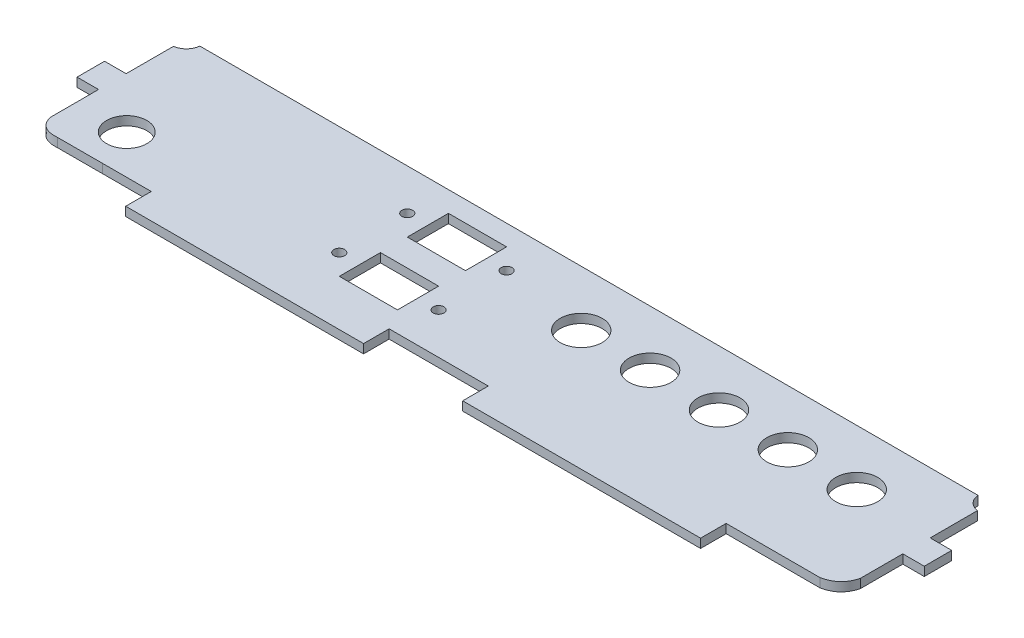
from build123d import *

# Parameters (mm, degrees)
BOSS_EXTRUDE1_DEPTH = 2.54
SKETCH3_R           = 5.969
CUT_EXTRUDE1_DEPTH  = 2.54
SKETCH4_R           = 1.524
SKETCH4_W           = 16.51
SKETCH4_H           = 11.684
CUT_EXTRUDE2_DEPTH  = 2.54
SKETCH5_R           = 5.715
CUT_EXTRUDE3_DEPTH  = 2.54
SKETCH6_W           = 1.070588236
SKETCH6_H           = 0.452941176
SKETCH6_H_2         = 2.882352942
BOSS_EXTRUDE2_DEPTH = 1.27


with BuildPart() as part:
    # Sketch2 → Boss-Extrude1 (new body)
    with BuildSketch(Plane(origin=(0, -13.278506449, 0), x_dir=(1, 0, 0), z_dir=(0, 1, 0))):
        with BuildLine():
            Line((-34.651907333, 8.791338925), (-34.651907333, 12.282836544))
            Line((-34.651907333, 12.282836544), (-34.651907333, 16.052095858))
            Line((-34.651907333, 16.052095858), (-6.504225525, 16.052095858))
            Line((-6.504225525, 16.052095858), (-6.504225525, 12.282836544))
            Line((-6.504225525, 12.282836544), (-6.504225525, 8.791338925))
            Line((-6.504225525, 8.791338925), (61.033352999, 8.795836626))
            Line((61.033352999, 8.795836626), (61.033352999, 12.261437791))
            Line((61.033352999, 12.261437791), (61.033352999, 16.052095858))
            Line((61.033352999, 16.052095858), (74.928287754, 16.052095858))
            Line((74.928287754, 16.052095858), (87.628299114, 16.052095858))
            add(Edge.make_bspline(
                [(87.628299114, 16.052095858), (92.376375428, 16.944548934), (93.595788319, 21.590182824)],
                knots=[0, 0, 0, 1, 1, 1], degree=2))
            Line((93.595788319, 21.590182824), (93.595788319, 33.644651336))
            Line((93.595788319, 33.644651336), (96.76835331, 33.644651336))
            Line((96.76835331, 33.644651336), (99.689276569, 33.644651336))
            Line((99.689276569, 33.644651336), (99.688757031, 41.446050547))
            Line((99.688757031, 41.446050547), (93.5671706, 41.446050547))
            Line((93.5671706, 41.446050547), (93.5671706, 54.894977019))
            ThreePointArc((93.5671706, 54.894977019), (91.056320502, 56.150010308), (89.8898168, 58.703193788))
            Line((89.8898168, 58.703193788), (67.098084888, 58.703193788))
            Line((67.098084888, 58.703193788), (-108.254217747, 58.703193788))
            Line((-108.254217747, 58.703193788), (-131.045949658, 58.703193788))
            ThreePointArc((-131.045949658, 58.703193788), (-132.21245336, 56.150010308), (-134.723303458, 54.894977019))
            Line((-134.723303458, 54.894977019), (-134.723303458, 41.446050547))
            Line((-134.723303458, 41.446050547), (-140.844889889, 41.446050547))
            Line((-140.844889889, 41.446050547), (-140.845409427, 33.644651336))
            Line((-140.845409427, 33.644651336), (-137.924486169, 33.644651336))
            Line((-137.924486169, 33.644651336), (-134.751921178, 33.644651336))
            Line((-134.751921178, 33.644651336), (-134.750317455, 20.009499149))
            add(Edge.make_bspline(
                [(-134.750317455, 20.009499149), (-133.771402633, 15.691001725), (-128.784431972, 16.03703279)],
                knots=[0, 0, 0, 1, 1, 1], degree=2))
            Line((-128.784431972, 16.03703279), (-116.084420612, 16.052095858))
            Line((-116.084420612, 16.052095858), (-102.189485857, 16.052095858))
            Line((-102.189485857, 16.052095858), (-102.189485857, 12.261437791))
            Line((-102.189485857, 12.261437791), (-102.189485857, 8.795836626))
            Line((-102.189485857, 8.795836626), (-34.651907333, 8.791338925))
        make_face()
    extrude(amount=BOSS_EXTRUDE1_DEPTH)

    # Sketch3 → Cut-Extrude1 (cut)
    with BuildSketch(Plane(origin=(0, -10.738506449, 0), x_dir=(1, 0, 0), z_dir=(0, 1, 0))):
        with Locations(Location((-6.989066429, 42.921095968, 0), (0, 0, 270))):
            Circle(SKETCH3_R)
        with Locations(Location((12.568933571, 42.921095968, 0), (0, 0, 270))):
            Circle(SKETCH3_R)
        with Locations(Location((32.126933571, 42.921095968, 0), (0, 0, 270))):
            Circle(SKETCH3_R)
        with Locations(Location((51.684933571, 42.921095968, 0), (0, 0, 270))):
            Circle(SKETCH3_R)
        with Locations(Location((71.242933571, 42.921095968, 0), (0, 0, 270))):
            Circle(SKETCH3_R)
    extrude(amount=-CUT_EXTRUDE1_DEPTH, mode=Mode.SUBTRACT)

    # Sketch4 → Cut-Extrude2 (cut)
    with BuildSketch(Plane(origin=(0, -10.738506449, 0), x_dir=(1, 0, 0), z_dir=(0, 1, 0))):
        with Locations(Location((-32.279112135, 47.029644823, 0), (0, 0, 270))):
            Circle(SKETCH4_R)
        with Locations(Location((-60.473112135, 47.029644823, 0), (0, 0, 90))):
            Circle(SKETCH4_R)
        with Locations(Location((-60.473112135, 27.725644823, 0), (0, 0, 270))):
            Circle(SKETCH4_R)
        with Locations(Location((-32.279112135, 27.725644823, 0), (0, 0, 90))):
            Circle(SKETCH4_R)
        with Locations((-46.376112135, 47.029644823)):
            Rectangle(SKETCH4_W, SKETCH4_H)
        with Locations((-46.376112135, 27.725644823)):
            Rectangle(SKETCH4_W, SKETCH4_H)
    extrude(amount=-CUT_EXTRUDE2_DEPTH, mode=Mode.SUBTRACT)

    # Sketch5 → Cut-Extrude3 (cut)
    with BuildSketch(Plane(origin=(0, -10.738506449, 0), x_dir=(1, 0, 0), z_dir=(0, 1, 0))):
        with Locations(Location((-120.283334311, 27.185206684, 0), (0, 0, 270))):
            Circle(SKETCH5_R)
    extrude(amount=-CUT_EXTRUDE3_DEPTH, mode=Mode.SUBTRACT)

    # Sketch6 → Boss-Extrude2 (add)
    # profile 1 of 12: a face of its own
    with BuildSketch(Plane.XZ.offset(13.278506449)):
        with BuildLine():
            Line((-112.734008416, -19.687217596), (-111.637041504, -19.687217596))
            add(Edge.make_bspline(
                [(-111.637041504, -19.687217596), (-111.601008667, -19.687211947), (-111.531071442, -19.687200982), (-111.429412377, -19.690802953), (-111.334184822, -19.695266897), (-111.245304398, -19.700602899), (-111.16292082, -19.709041908), (-111.087015383, -19.719442496), (-111.017373241, -19.730649661), (-110.935507396, -19.748368995), (-110.843444854, -19.773606128), (-110.745550324, -19.812012352), (-110.661428024, -19.85590395), (-110.592984403, -19.908411948), (-110.53629973, -19.96613189), (-110.490342298, -20.029473817), (-110.454414733, -20.098969692), (-110.432648346, -20.161628981), (-110.41884369, -20.216176565), (-110.41101832, -20.262950346), (-110.402864753, -20.314762645), (-110.39775236, -20.372177024), (-110.392094766, -20.434526855), (-110.389312701, -20.502148845), (-110.387257103, -20.575071756), (-110.38705467, -20.625481558), (-110.386949593, -20.651647743)],
                knots=[0, 0, 0, 0, 1.377982312, 2.674567649, 3.889839969, 5.024138552, 6.079412034, 7.056120119, 7.954169122, 8.776225565, 10.258906682, 11.599246215, 12.791944274, 13.87465655, 14.883885279, 15.876478616, 16.85597234, 17.865101075, 18.406193072, 19.006295369, 19.67791914, 20.411631679, 21.209939595, 22.072139174, 22.999306481, 24, 24, 24, 24], degree=3))
            Line((-110.386949593, -20.651647743), (-110.386949593, -20.952107301))
            add(Edge.make_bspline(
                [(-110.386949593, -20.952107301), (-110.387166144, -20.978707163), (-110.387583776, -21.030006593), (-110.39162343, -21.104247405), (-110.397427418, -21.172848069), (-110.407756863, -21.235802887), (-110.418338632, -21.293490876), (-110.433794424, -21.345234047), (-110.449805228, -21.391961084), (-110.470301329, -21.433197839), (-110.493906499, -21.4707992), (-110.521653763, -21.505414347), (-110.553609273, -21.538145787), (-110.590254928, -21.568056163), (-110.631223285, -21.595919318), (-110.676463124, -21.621594278), (-110.726029334, -21.645452892), (-110.780248638, -21.666667065), (-110.83887419, -21.684894779), (-110.901351643, -21.702151274), (-110.968580784, -21.715001924), (-111.039705186, -21.727043464), (-111.115381204, -21.734845165), (-111.195154547, -21.741506685), (-111.27949836, -21.745330441), (-111.337221763, -21.745800229), (-111.366820916, -21.746041125)],
                knots=[0, 0, 0, 0, 1.291137889, 2.490036882, 3.608873441, 4.630748452, 5.586298936, 6.452920994, 7.249893365, 7.980894276, 8.682771907, 9.40143594, 10.130283677, 10.899433994, 11.693545186, 12.532910727, 13.422309217, 14.361902714, 15.356253204, 16.401773359, 17.506375272, 18.677097529, 19.902686196, 21.197847375, 22.563124469, 24, 24, 24, 24], degree=3))
            Line((-111.366820916, -21.746041125), (-111.663420181, -21.746041125))
            Line((-111.663420181, -21.746041125), (-111.663420181, -23.187217596))
            Line((-111.663420181, -23.187217596), (-112.734008416, -23.187217596))
            Line((-112.734008416, -23.187217596), (-112.734008416, -19.687217596))
        make_face()
        with BuildLine():
            Line((-111.663420181, -20.263688184), (-111.663420181, -21.16764039))
            add(Edge.make_bspline(
                [(-111.663420181, -21.16764039), (-111.647980055, -21.168116881), (-111.619461998, -21.168996965), (-111.590933189, -21.169390204), (-111.577850328, -21.169570537)],
                knots=[0, 0, 0, 0, 1.082831556, 2, 2, 2, 2], degree=3))
            add(Edge.make_bspline(
                [(-111.577850328, -21.169570537), (-111.553156332, -21.168898706), (-111.507306675, -21.167651309), (-111.444299818, -21.157123916), (-111.393767469, -21.136877331), (-111.359570215, -21.113611173), (-111.339434551, -21.089098438), (-111.327477355, -21.066542679), (-111.316188114, -21.040448854), (-111.307522756, -21.009945304), (-111.301365907, -20.974984996), (-111.295956556, -20.93617339), (-111.293887452, -20.892935396), (-111.293193532, -20.862891302), (-111.292831945, -20.847235978)],
                knots=[0, 0, 0, 0, 1.745339567, 3.240594206, 4.48460764, 5.569947629, 6.119139576, 6.70945562, 7.368186125, 8.125998689, 8.943453317, 9.875901568, 10.893178495, 12, 12, 12, 12], degree=3))
            Line((-111.292831945, -20.847235978), (-111.292831945, -20.55514039))
            add(Edge.make_bspline(
                [(-111.292831945, -20.55514039), (-111.293540477, -20.527416353), (-111.294836278, -20.47671315), (-111.307468797, -20.408270251), (-111.3295063, -20.354777901), (-111.357729165, -20.321683388), (-111.38612752, -20.304470121), (-111.411780949, -20.293632574), (-111.441916321, -20.284090448), (-111.47701805, -20.276421465), (-111.516846495, -20.271024085), (-111.561456517, -20.266345785), (-111.610849766, -20.263897881), (-111.645403272, -20.263760051), (-111.663420181, -20.263688184)],
                knots=[0, 0, 0, 0, 1.772995338, 3.242548813, 4.428381502, 5.439307395, 5.957193692, 6.541067122, 7.218146696, 7.97731862, 8.837122214, 9.78893594, 10.847105721, 12, 12, 12, 12], degree=3))
        make_face(mode=Mode.SUBTRACT)
    # profile 2 of 12: a face of its own
    with BuildSketch(Plane.XZ.offset(13.278506449)):
        with BuildLine():
            Line((-107.792831945, -21.320122007), (-107.792831945, -22.02076539))
            add(Edge.make_bspline(
                [(-107.792831945, -22.02076539), (-107.79296511, -22.051862543), (-107.793222282, -22.111918678), (-107.794910518, -22.198807429), (-107.79890578, -22.279237543), (-107.8039406, -22.353251809), (-107.810280272, -22.420845092), (-107.817968448, -22.482000688), (-107.82664662, -22.536844715), (-107.841181011, -22.601442178), (-107.866445974, -22.676985478), (-107.908443529, -22.763852412), (-107.965712205, -22.846101517), (-108.033348552, -22.9256687), (-108.112594884, -22.999337371), (-108.204628502, -23.061668401), (-108.306373469, -23.114931566), (-108.418853803, -23.157068594), (-108.54083515, -23.188686779), (-108.671420682, -23.211672672), (-108.8107647, -23.226177797), (-108.906704248, -23.227641143), (-108.95606724, -23.228394066)],
                knots=[0, 0, 0, 0, 0.951826186, 1.838206891, 2.65967189, 3.416374914, 4.108730704, 4.73728139, 5.302752647, 5.807553382, 6.762407774, 7.73412555, 8.750045002, 9.820868952, 10.926535816, 12.049947676, 13.212620023, 14.43418931, 15.717495654, 17.064349177, 18.489543579, 20, 20, 20, 20], degree=3))
            add(Edge.make_bspline(
                [(-108.95606724, -23.228394066), (-109.010565417, -23.227771884), (-109.115421762, -23.226574785), (-109.266045831, -23.214220095), (-109.403845387, -23.194531954), (-109.528912937, -23.167584529), (-109.640799647, -23.131651437), (-109.739832056, -23.088125122), (-109.825611052, -23.035838562), (-109.898960756, -22.975402297), (-109.959853507, -22.906508732), (-110.011794354, -22.831676768), (-110.053538523, -22.749708493), (-110.081545174, -22.676449611), (-110.098151701, -22.612309965), (-110.110057394, -22.558335643), (-110.118486048, -22.49826616), (-110.126196748, -22.432840888), (-110.132772909, -22.361635032), (-110.137066061, -22.284812231), (-110.139703243, -22.202218205), (-110.13982687, -22.14536926), (-110.139890769, -22.115985978)],
                knots=[0, 0, 0, 0, 1.707197647, 3.284706255, 4.731011971, 6.066207974, 7.288044814, 8.406936959, 9.447572882, 10.42576728, 11.372722643, 12.319558801, 13.27221848, 14.248194852, 14.769758696, 15.346999647, 15.978942594, 16.669045749, 17.4112251, 18.218920944, 19.079420947, 20, 20, 20, 20], degree=3))
            Line((-110.139890769, -22.115985978), (-110.139890769, -21.382530096))
            add(Edge.make_bspline(
                [(-110.139890769, -21.382530096), (-110.139789002, -21.350136612), (-110.13959139, -21.287234752), (-110.13390453, -21.195637306), (-110.126644292, -21.10951878), (-110.115662379, -21.028787764), (-110.101736169, -20.953567186), (-110.084330282, -20.883738309), (-110.064003815, -20.819349469), (-110.039861958, -20.760000549), (-110.012119437, -20.704291169), (-109.978493976, -20.652404786), (-109.939995511, -20.603081774), (-109.897332309, -20.555961064), (-109.848143029, -20.512878638), (-109.795099328, -20.471672924), (-109.736524244, -20.433490249), (-109.673190845, -20.398262371), (-109.604761462, -20.3667563), (-109.531671952, -20.339068417), (-109.45419307, -20.315179266), (-109.371710052, -20.296779626), (-109.285146766, -20.282140063), (-109.193925813, -20.271074348), (-109.09813559, -20.264613444), (-109.032639663, -20.264001078), (-108.999173857, -20.263688184)],
                knots=[0, 0, 0, 0, 1.258706802, 2.44416437, 3.565534099, 4.617009745, 5.609303903, 6.537196619, 7.412339861, 8.23113112, 9.02510996, 9.827401574, 10.629346738, 11.455234546, 12.293479631, 13.167073488, 14.0640531, 15.008016506, 15.981366345, 16.989117999, 18.043760349, 19.129561911, 20.271010871, 21.45476768, 22.699487801, 24, 24, 24, 24], degree=3))
            add(Edge.make_bspline(
                [(-108.999173857, -20.263688184), (-108.943574138, -20.264451365), (-108.836390017, -20.265922612), (-108.681816788, -20.283458204), (-108.539133349, -20.309208298), (-108.409578597, -20.348370218), (-108.293090152, -20.39496967), (-108.190035772, -20.448267588), (-108.100558741, -20.507947772), (-108.026300007, -20.575572199), (-107.964953421, -20.646805282), (-107.912272254, -20.718258386), (-107.871917009, -20.792053215), (-107.845306658, -20.85531873), (-107.830140125, -20.908936894), (-107.819694431, -20.953319177), (-107.811650809, -21.002586104), (-107.804381081, -21.056620256), (-107.799593758, -21.11569078), (-107.795739796, -21.179611249), (-107.792997588, -21.248254319), (-107.792888302, -21.295670695), (-107.792831945, -21.320122007)],
                knots=[0, 0, 0, 0, 1.801631376, 3.473152024, 5.037220677, 6.495666735, 7.852619042, 9.099671228, 10.250940686, 11.328981893, 12.344089199, 13.29540261, 14.201001808, 15.064772264, 15.513644716, 16.006116267, 16.54220296, 17.131223678, 17.773294144, 18.462883315, 19.207351473, 20, 20, 20, 20], degree=3))
        make_face()
        with BuildLine():
            add(Edge.make_bspline(
                [(-108.82224371, -21.096224949), (-108.822401311, -21.078423723), (-108.822699466, -21.044746882), (-108.8239962, -20.996702046), (-108.825853771, -20.954009257), (-108.828320555, -20.916231956), (-108.831740592, -20.883711652), (-108.837464053, -20.856419975), (-108.841782696, -20.833946095), (-108.850267789, -20.811528422), (-108.865535822, -20.789516429), (-108.891196172, -20.769448755), (-108.925684432, -20.76005108), (-108.950456118, -20.758591404), (-108.963787828, -20.757805831)],
                knots=[0, 0, 0, 0, 1.529875524, 2.894259986, 4.130367399, 5.201898635, 6.14835708, 6.936372256, 7.598090249, 8.111515645, 8.985769879, 9.866797629, 10.851945915, 12, 12, 12, 12], degree=3))
            add(Edge.make_bspline(
                [(-108.963787828, -20.757805831), (-108.977349522, -20.758549418), (-109.002365496, -20.759921042), (-109.037232993, -20.76976444), (-109.063847493, -20.789404431), (-109.080351448, -20.811396969), (-109.089654093, -20.833887938), (-109.095014952, -20.85625574), (-109.09920517, -20.883861129), (-109.103942765, -20.91618139), (-109.107017739, -20.953989537), (-109.108679566, -20.996703033), (-109.110037201, -21.044746589), (-109.110326228, -21.078423622), (-109.110479004, -21.096224949)],
                knots=[0, 0, 0, 0, 1.15856243, 2.137090529, 3.04157699, 3.931306771, 4.448136327, 5.109727602, 5.889229331, 6.831642005, 7.897388628, 9.125189412, 10.480405224, 12, 12, 12, 12], degree=3))
            Line((-109.110479004, -21.096224949), (-109.110479004, -22.404221272))
            add(Edge.make_bspline(
                [(-109.110479004, -22.404221272), (-109.110121798, -22.435539015), (-109.10947529, -22.492221109), (-109.104811553, -22.56856294), (-109.096786692, -22.627157927), (-109.084542912, -22.670321806), (-109.06507154, -22.700868567), (-109.037904873, -22.72058158), (-109.004187768, -22.732570092), (-108.97955515, -22.733681255), (-108.966361357, -22.734276419)],
                knots=[0, 0, 0, 0, 1.835619617, 3.322294424, 4.479629889, 5.298520436, 5.933029576, 6.561533762, 7.229524616, 8, 8, 8, 8], degree=3))
            add(Edge.make_bspline(
                [(-108.966361357, -22.734276419), (-108.952791435, -22.733540227), (-108.927760282, -22.732182243), (-108.893282887, -22.722334281), (-108.866876693, -22.703559315), (-108.847518431, -22.675844747), (-108.836277591, -22.63604195), (-108.827816034, -22.582787209), (-108.823276059, -22.513230552), (-108.822611545, -22.461698546), (-108.82224371, -22.433173478)],
                knots=[0, 0, 0, 0, 0.849535228, 1.56705728, 2.211546411, 2.837309577, 3.643864105, 4.773790255, 6.214161309, 8, 8, 8, 8], degree=3))
            Line((-108.82224371, -22.433173478), (-108.82224371, -21.096224949))
        make_face(mode=Mode.SUBTRACT)
    # profile 3 of 12: a face of its own
    with BuildSketch(Plane.XZ.offset(13.278506449)):
        with BuildLine():
            Line((-104.086949593, -20.304864654), (-104.509008416, -23.187217596))
            Line((-104.509008416, -23.187217596), (-105.600184887, -23.187217596))
            add(Edge.make_bspline(
                [(-105.600184887, -23.187217596), (-105.60788002, -23.140675397), (-105.623874162, -23.0439386), (-105.649314147, -22.893265458), (-105.67509898, -22.7311789), (-105.704715155, -22.558075149), (-105.734353094, -22.373253994), (-105.767654769, -22.177388898), (-105.801426839, -21.970130046), (-105.824907008, -21.828388643), (-105.836949593, -21.75569186)],
                knots=[0, 0, 0, 0, 0.780287423, 1.62180793, 2.527484367, 3.494970697, 4.526610144, 5.623561146, 6.78116447, 8, 8, 8, 8], degree=3))
            add(Edge.make_bspline(
                [(-105.836949593, -21.75569186), (-105.859424687, -21.892524993), (-105.903569095, -22.16128549), (-105.9482145, -22.429963214), (-105.97012974, -22.561849949)],
                knots=[0, 0, 0, 0, 1.018253305, 2, 2, 2, 2], degree=3))
            Line((-105.97012974, -22.561849949), (-106.073714298, -23.187217596))
            Line((-106.073714298, -23.187217596), (-107.164890769, -23.187217596))
            Line((-107.164890769, -23.187217596), (-107.628126063, -20.304864654))
            Line((-107.628126063, -20.304864654), (-106.767923857, -20.304864654))
            add(Edge.make_bspline(
                [(-106.767923857, -20.304864654), (-106.766860008, -20.311514279), (-106.764114067, -20.328677884), (-106.758762798, -20.360137869), (-106.752889945, -20.403185934), (-106.743168347, -20.457262419), (-106.733525952, -20.523061606), (-106.720115964, -20.599895526), (-106.706269117, -20.688338388), (-106.690123928, -20.788052659), (-106.671884774, -20.89928781), (-106.653074244, -21.022320787), (-106.630678236, -21.156420931), (-106.608029348, -21.302191645), (-106.581827841, -21.458817633), (-106.554998743, -21.627235467), (-106.526094945, -21.806961324), (-106.506077459, -21.930693501), (-106.495773122, -21.994386713)],
                knots=[0, 0, 0, 0, 0.18888579, 0.487540447, 0.89503317, 1.407292323, 2.028360722, 2.760159511, 3.594820345, 4.539249295, 5.593446715, 6.756464315, 8.030199373, 9.406807753, 10.894144608, 12.484348507, 14.190259485, 16, 16, 16, 16], degree=3))
            add(Edge.make_bspline(
                [(-106.495773122, -21.994386713), (-106.494527138, -21.984730274), (-106.491588846, -21.96195836), (-106.485345672, -21.922834775), (-106.479507598, -21.873367972), (-106.470838976, -21.813787355), (-106.460338942, -21.74417889), (-106.44983559, -21.664062829), (-106.436566143, -21.573861658), (-106.422670802, -21.473242917), (-106.407053882, -21.362391288), (-106.390685464, -21.241569421), (-106.371414005, -21.110679692), (-106.352650683, -20.969215593), (-106.331406577, -20.817592191), (-106.307725615, -20.655808226), (-106.284523142, -20.483665775), (-106.267667542, -20.365545747), (-106.259008416, -20.304864654)],
                knots=[0, 0, 0, 0, 0.273929467, 0.645983326, 1.114497139, 1.675132682, 2.339878224, 3.095083398, 3.948408959, 4.904990339, 5.952879687, 7.098054036, 8.335376099, 9.675124406, 11.112984307, 12.642997276, 14.275427141, 16, 16, 16, 16], degree=3))
            Line((-106.259008416, -20.304864654), (-105.45606724, -20.304864654))
            Line((-105.45606724, -20.304864654), (-105.219302534, -21.994386713))
            add(Edge.make_bspline(
                [(-105.219302534, -21.994386713), (-105.212627657, -21.930456255), (-105.199088254, -21.800778911), (-105.174914481, -21.603502138), (-105.148247658, -21.400527827), (-105.117017344, -21.192135823), (-105.083119648, -20.978236397), (-105.044856631, -20.758917053), (-105.003824526, -20.533696807), (-104.974325358, -20.38182748), (-104.959376063, -20.304864654)],
                knots=[0, 0, 0, 0, 0.902104729, 1.82984055, 2.789331074, 3.775180248, 4.787117821, 5.828740949, 6.899670953, 8, 8, 8, 8], degree=3))
            Line((-104.959376063, -20.304864654), (-104.086949593, -20.304864654))
        make_face()
    # profile 4 of 12: a face of its own
    with BuildSketch(Plane.XZ.offset(13.278506449)):
        with BuildLine():
            Line((-101.616361357, -21.787217596), (-102.934008416, -21.787217596))
            Line((-102.934008416, -21.787217596), (-102.934008416, -22.420949213))
            add(Edge.make_bspline(
                [(-102.934008416, -22.420949213), (-102.933767464, -22.451204869), (-102.93333284, -22.505779246), (-102.927475901, -22.578827478), (-102.919959633, -22.634623557), (-102.906755436, -22.675321971), (-102.886273308, -22.703639111), (-102.85866646, -22.722003836), (-102.8242401, -22.732192276), (-102.799399352, -22.733547214), (-102.786030475, -22.734276419)],
                knots=[0, 0, 0, 0, 1.828033278, 3.297359637, 4.426751893, 5.226298964, 5.856249794, 6.499789233, 7.192611482, 8, 8, 8, 8], degree=3))
            add(Edge.make_bspline(
                [(-102.786030475, -22.734276419), (-102.769398606, -22.733602128), (-102.738208934, -22.732337632), (-102.695712664, -22.718159999), (-102.661855984, -22.694005018), (-102.637992274, -22.657668468), (-102.622797637, -22.608672789), (-102.611621635, -22.544727287), (-102.606189537, -22.463713438), (-102.605159257, -22.404010675), (-102.604596651, -22.371408772)],
                knots=[0, 0, 0, 0, 0.856756323, 1.606671429, 2.280429667, 2.965841891, 3.810401001, 4.914505672, 6.315103308, 8, 8, 8, 8], degree=3))
            Line((-102.604596651, -22.371408772), (-102.604596651, -21.993099949))
            Line((-102.604596651, -21.993099949), (-101.616361357, -21.993099949))
            Line((-101.616361357, -21.993099949), (-101.616361357, -22.202842596))
            add(Edge.make_bspline(
                [(-101.616361357, -22.202842596), (-101.616864867, -22.244027202), (-101.61781241, -22.321531669), (-101.624431298, -22.43027676), (-101.636377168, -22.524042044), (-101.653271547, -22.606063786), (-101.681392448, -22.681377737), (-101.721351574, -22.755848624), (-101.774956767, -22.832256669), (-101.839391368, -22.910197586), (-101.914682665, -22.985565709), (-102.002570579, -23.050331562), (-102.099193965, -23.106420173), (-102.206645691, -23.151613238), (-102.32604807, -23.186300499), (-102.458543635, -23.211029376), (-102.605129876, -23.225584219), (-102.707503326, -23.227430417), (-102.760938563, -23.228394066)],
                knots=[0, 0, 0, 0, 1.117768799, 2.103506217, 2.954686016, 3.68196277, 4.370696834, 5.128384342, 5.969534957, 6.899587424, 7.870922622, 8.8522511, 9.853588351, 10.896813613, 12.007360871, 13.221953554, 14.549960254, 16, 16, 16, 16], degree=3))
            add(Edge.make_bspline(
                [(-102.760938563, -23.228394066), (-102.813300595, -23.227395164), (-102.915239814, -23.225450485), (-103.063487768, -23.210714749), (-103.202252055, -23.185724783), (-103.330906439, -23.151437947), (-103.447778714, -23.107846845), (-103.552357552, -23.057319034), (-103.643232985, -22.998872677), (-103.720024956, -22.93249807), (-103.783664945, -22.860594884), (-103.837262547, -22.785424821), (-103.879753979, -22.706465164), (-103.907694931, -22.637269383), (-103.923507359, -22.577976176), (-103.93457727, -22.529099471), (-103.943518826, -22.475394175), (-103.950305621, -22.41696002), (-103.956100394, -22.353674625), (-103.96064964, -22.28568056), (-103.963210577, -22.212942442), (-103.963348941, -22.162954879), (-103.963420181, -22.137217596)],
                knots=[0, 0, 0, 0, 1.668410191, 3.248086945, 4.741390851, 6.157149823, 7.484931518, 8.710538505, 9.851665232, 10.917605596, 11.934069353, 12.904892863, 13.852835894, 14.785605692, 15.274707751, 15.80693255, 16.382173284, 17.008601113, 17.681158762, 18.407148507, 19.179882594, 20, 20, 20, 20], degree=3))
            Line((-103.963420181, -22.137217596), (-103.963420181, -21.302750684))
            add(Edge.make_bspline(
                [(-103.963420181, -21.302750684), (-103.963091985, -21.27228542), (-103.962453455, -21.213012902), (-103.956285559, -21.126530844), (-103.947761621, -21.045077626), (-103.934821096, -20.968587089), (-103.918127102, -20.897019452), (-103.897946538, -20.830187417), (-103.873058149, -20.768688341), (-103.845536429, -20.711328586), (-103.812963345, -20.658288895), (-103.776224663, -20.608305178), (-103.734149226, -20.562031862), (-103.687648533, -20.518796528), (-103.636528829, -20.478611119), (-103.580386279, -20.442137738), (-103.519615521, -20.408417376), (-103.431382607, -20.368343946), (-103.313133277, -20.325051396), (-103.161426448, -20.289999945), (-102.999895734, -20.267198361), (-102.888839304, -20.264880512), (-102.831710622, -20.263688184)],
                knots=[0, 0, 0, 0, 1.033252453, 2.010272227, 2.939768806, 3.810438358, 4.639797737, 5.431381819, 6.175726005, 6.888248243, 7.586932323, 8.283872061, 8.989527893, 9.705014971, 10.435580459, 11.192229854, 11.973721078, 12.790736772, 14.477565644, 16.235013966, 18.063248664, 20, 20, 20, 20], degree=3))
            add(Edge.make_bspline(
                [(-102.831710622, -20.263688184), (-102.796528465, -20.263990327), (-102.727817275, -20.264580415), (-102.627117699, -20.271179423), (-102.531103594, -20.281920315), (-102.439874086, -20.297436103), (-102.353207284, -20.316544893), (-102.271293039, -20.340329774), (-102.194159382, -20.368586537), (-102.121715795, -20.400841672), (-102.054513767, -20.436693856), (-101.9921643, -20.475588256), (-101.934990832, -20.51708939), (-101.88328003, -20.561786059), (-101.836486302, -20.608853051), (-101.795357705, -20.659203535), (-101.758927706, -20.71222152), (-101.727852766, -20.768753548), (-101.701305927, -20.829584922), (-101.678087945, -20.895322054), (-101.658907316, -20.966973139), (-101.643732503, -21.044411168), (-101.631558109, -21.127722611), (-101.622583959, -21.216801206), (-101.617571274, -21.311700346), (-101.6167724, -21.376733921), (-101.616361357, -21.410195537)],
                knots=[0, 0, 0, 0, 1.310015631, 2.558476796, 3.756195157, 4.906371301, 6.003063525, 7.059526267, 8.080307888, 9.059891795, 10.010292918, 10.914434054, 11.794624434, 12.638370059, 13.457255805, 14.263068061, 15.056114167, 15.849682899, 16.661410177, 17.525289164, 18.443605123, 19.420972627, 20.462354432, 21.578103443, 22.753865646, 24, 24, 24, 24], degree=3))
            Line((-101.616361357, -21.410195537), (-101.616361357, -21.787217596))
        make_face()
        with BuildLine():
            Line((-102.645773122, -21.334276419), (-102.645773122, -21.119386713))
            add(Edge.make_bspline(
                [(-102.645773122, -21.119386713), (-102.645934757, -21.101156782), (-102.646242854, -21.06640825), (-102.647503501, -21.016860239), (-102.649431646, -20.972458396), (-102.651780329, -20.933167485), (-102.655456427, -20.898764191), (-102.660827616, -20.86969229), (-102.665544362, -20.845175695), (-102.673855247, -20.820302221), (-102.687291897, -20.794167825), (-102.713632857, -20.77297062), (-102.745947112, -20.759142127), (-102.769998622, -20.758270333), (-102.782813563, -20.757805831)],
                knots=[0, 0, 0, 0, 1.509968631, 2.878189217, 4.105001558, 5.19087821, 6.13833646, 6.967704305, 7.640126502, 8.201845286, 9.140436864, 10.022889743, 10.946571338, 12, 12, 12, 12], degree=3))
            add(Edge.make_bspline(
                [(-102.782813563, -20.757805831), (-102.798339431, -20.758159807), (-102.826660809, -20.758805511), (-102.864382079, -20.769536499), (-102.893395583, -20.787449327), (-102.909054487, -20.810270048), (-102.916063337, -20.833482083), (-102.921249811, -20.856679975), (-102.924724951, -20.88578374), (-102.927767721, -20.920776465), (-102.931280359, -20.961916773), (-102.933017828, -21.009139291), (-102.933326492, -21.062340455), (-102.933772564, -21.099656521), (-102.934008416, -21.119386713)],
                knots=[0, 0, 0, 0, 1.2277596, 2.239607127, 3.074719044, 3.881633357, 4.365781945, 4.993125751, 5.765406405, 6.687943148, 7.779980435, 9.039846784, 10.434872792, 12, 12, 12, 12], degree=3))
            Line((-102.934008416, -21.119386713), (-102.934008416, -21.334276419))
            Line((-102.934008416, -21.334276419), (-102.645773122, -21.334276419))
        make_face(mode=Mode.SUBTRACT)
    # profile 5 of 12: a face of its own
    with BuildSketch(Plane.XZ.offset(13.278506449)):
        with BuildLine():
            Line((-100.257537828, -20.304864654), (-100.298714298, -20.713412449))
            add(Edge.make_bspline(
                [(-100.298714298, -20.713412449), (-100.279516982, -20.67969135), (-100.242201127, -20.614144084), (-100.175214153, -20.526206681), (-100.102458864, -20.449790738), (-100.022186636, -20.387218924), (-99.935855214, -20.336736622), (-99.843307879, -20.29860557), (-99.743880644, -20.272854371), (-99.674996979, -20.266782621), (-99.639890769, -20.263688184)],
                knots=[0, 0, 0, 0, 1.11154607, 2.160629716, 3.160871105, 4.128972346, 5.068690582, 6.019947142, 6.9908761, 8, 8, 8, 8], degree=3))
            Line((-99.639890769, -20.263688184), (-99.639890769, -21.293099949))
            add(Edge.make_bspline(
                [(-99.639890769, -21.293099949), (-99.663052796, -21.293457448), (-99.707674616, -21.294146173), (-99.772307506, -21.296295773), (-99.832166175, -21.301628001), (-99.887375851, -21.308454221), (-99.937815911, -21.317562236), (-99.983604272, -21.327973768), (-100.024207407, -21.341895074), (-100.071270432, -21.360602107), (-100.120882444, -21.390196133), (-100.17111034, -21.431124825), (-100.206615072, -21.4808074), (-100.225957735, -21.528192174), (-100.234460432, -21.572599362), (-100.241066551, -21.615267822), (-100.24565918, -21.66729154), (-100.250427356, -21.728606535), (-100.253206145, -21.799429456), (-100.256017096, -21.879629776), (-100.257005142, -21.969078583), (-100.257354684, -22.031703127), (-100.257537828, -22.06451539)],
                knots=[0, 0, 0, 0, 1.14813478, 2.211890285, 3.204042988, 4.125588817, 4.96790372, 5.743897548, 6.449750049, 7.09322501, 8.250816474, 9.298789572, 10.281100609, 11.244306507, 11.80924854, 12.518772808, 13.383915222, 14.396412933, 15.56681623, 16.896128216, 18.373719818, 20, 20, 20, 20], degree=3))
            Line((-100.257537828, -22.06451539), (-100.257537828, -23.187217596))
            Line((-100.257537828, -23.187217596), (-101.286949593, -23.187217596))
            Line((-101.286949593, -23.187217596), (-101.286949593, -20.304864654))
            Line((-101.286949593, -20.304864654), (-100.257537828, -20.304864654))
        make_face()
    # profile 6 of 12: a face of its own
    with BuildSketch(Plane.XZ.offset(13.278506449)):
        with Locations((-97.951655475, -19.913688184)):
            Rectangle(SKETCH6_W, SKETCH6_H)
    # profile 7 of 12: a face of its own
    with BuildSketch(Plane.XZ.offset(13.278506449)):
        with Locations((-97.951655475, -21.746041125)):
            Rectangle(SKETCH6_W, SKETCH6_H_2)
    # profile 8 of 12: a face of its own
    with BuildSketch(Plane.XZ.offset(13.278506449)):
        with BuildLine():
            Line((-96.016361357, -20.304864654), (-96.016361357, -20.562217596))
            add(Edge.make_bspline(
                [(-96.016361357, -20.562217596), (-95.997029504, -20.538274351), (-95.958883572, -20.491029143), (-95.891521448, -20.430631629), (-95.819208191, -20.378292684), (-95.739772118, -20.336466062), (-95.654355476, -20.303276225), (-95.562427249, -20.280652127), (-95.464603431, -20.265876425), (-95.39726994, -20.264430742), (-95.362684887, -20.263688184)],
                knots=[0, 0, 0, 0, 0.987860847, 1.949263403, 2.898199879, 3.851259958, 4.826895383, 5.836883251, 6.888940612, 8, 8, 8, 8], degree=3))
            add(Edge.make_bspline(
                [(-95.362684887, -20.263688184), (-95.31991903, -20.264737793), (-95.238161974, -20.26674437), (-95.121487278, -20.286980539), (-95.016985675, -20.31993357), (-94.92547843, -20.366486347), (-94.848347192, -20.423232565), (-94.784039695, -20.486593156), (-94.736430559, -20.558655671), (-94.708923451, -20.624882043), (-94.693890729, -20.68302995), (-94.684456869, -20.733593296), (-94.67627285, -20.790704322), (-94.66908751, -20.854407613), (-94.664236349, -20.924824582), (-94.660435411, -21.002044665), (-94.657694446, -21.08612606), (-94.657591291, -21.144476289), (-94.657537828, -21.174717596)],
                knots=[0, 0, 0, 0, 1.519571125, 2.905019793, 4.195326805, 5.402735124, 6.537610952, 7.589198981, 8.596029901, 9.587463566, 10.123920861, 10.729680834, 11.415634167, 12.175295324, 13.00881026, 13.925123045, 14.92464875, 16, 16, 16, 16], degree=3))
            Line((-94.657537828, -21.174717596), (-94.657537828, -23.187217596))
            Line((-94.657537828, -23.187217596), (-95.686949593, -23.187217596))
            Line((-95.686949593, -23.187217596), (-95.686949593, -21.18694186))
            add(Edge.make_bspline(
                [(-95.686949593, -21.18694186), (-95.687194152, -21.163351683), (-95.687658818, -21.118530141), (-95.687855936, -21.054818436), (-95.689904544, -20.998406589), (-95.692510439, -20.949298668), (-95.695238837, -20.907376868), (-95.700095765, -20.8729257), (-95.704007081, -20.845436038), (-95.711253639, -20.819044797), (-95.726449071, -20.792618197), (-95.75673094, -20.771052987), (-95.797211513, -20.759267972), (-95.827336217, -20.758325263), (-95.843934887, -20.757805831)],
                knots=[0, 0, 0, 0, 1.621852137, 3.081533208, 4.379715016, 5.501771975, 6.462930654, 7.265741028, 7.893509541, 8.369430122, 9.143147934, 9.933405095, 10.861309097, 12, 12, 12, 12], degree=3))
            add(Edge.make_bspline(
                [(-95.843934887, -20.757805831), (-95.861208059, -20.758438263), (-95.893037789, -20.759603661), (-95.936233191, -20.773721302), (-95.969285455, -20.798362696), (-95.98669226, -20.828120096), (-95.995532905, -20.857811025), (-96.001121411, -20.888449), (-96.00500541, -20.926992058), (-96.009919984, -20.973252573), (-96.012861147, -21.027352769), (-96.014599208, -21.089352346), (-96.015906089, -21.159271572), (-96.01620442, -21.20860181), (-96.016361357, -21.234552154)],
                knots=[0, 0, 0, 0, 1.075791975, 1.982390172, 2.794271542, 3.593791058, 4.085269691, 4.726331424, 5.535555962, 6.504631162, 7.631904951, 8.918569393, 10.379002619, 12, 12, 12, 12], degree=3))
            Line((-96.016361357, -21.234552154), (-96.016361357, -23.187217596))
            Line((-96.016361357, -23.187217596), (-97.045773122, -23.187217596))
            Line((-97.045773122, -23.187217596), (-97.045773122, -20.304864654))
            Line((-97.045773122, -20.304864654), (-96.016361357, -20.304864654))
        make_face()
    # profile 9 of 12: a face of its own
    with BuildSketch(Plane.XZ.offset(13.278506449)):
        with BuildLine():
            Line((-69.246133592, -25.782078828), (-68.14916668, -25.782078828))
            add(Edge.make_bspline(
                [(-68.14916668, -25.782078828), (-68.113133844, -25.78207318), (-68.043196618, -25.782062215), (-67.941537554, -25.785664186), (-67.846309998, -25.79012813), (-67.757429574, -25.795464132), (-67.675045996, -25.803903141), (-67.599140559, -25.814303729), (-67.529498417, -25.825510894), (-67.447632573, -25.843230228), (-67.35557003, -25.868467361), (-67.2576755, -25.906873585), (-67.1735532, -25.950765183), (-67.105109579, -26.003273181), (-67.048424906, -26.060993123), (-67.002467474, -26.12433505), (-66.966539909, -26.193830924), (-66.944773522, -26.256490214), (-66.930968866, -26.311037798), (-66.923143496, -26.357811579), (-66.914989929, -26.409623878), (-66.909877537, -26.467038257), (-66.904219942, -26.529388088), (-66.901437878, -26.597010078), (-66.899382279, -26.669932988), (-66.899179846, -26.720342791), (-66.899074769, -26.746508976)],
                knots=[0, 0, 0, 0, 1.377982312, 2.674567649, 3.889839969, 5.024138552, 6.079412034, 7.056120119, 7.954169122, 8.776225565, 10.258906682, 11.599246215, 12.791944274, 13.87465655, 14.883885279, 15.876478616, 16.85597234, 17.865101075, 18.406193072, 19.006295369, 19.67791914, 20.411631679, 21.209939595, 22.072139174, 22.999306481, 24, 24, 24, 24], degree=3))
            Line((-66.899074769, -26.746508976), (-66.899074769, -27.046968534))
            add(Edge.make_bspline(
                [(-66.899074769, -27.046968534), (-66.89929132, -27.073568396), (-66.899708952, -27.124867826), (-66.903748606, -27.199108637), (-66.909552594, -27.267709302), (-66.919882039, -27.33066412), (-66.930463808, -27.388352109), (-66.9459196, -27.44009528), (-66.961930404, -27.486822317), (-66.982426505, -27.528059071), (-67.006031675, -27.565660433), (-67.033778939, -27.60027558), (-67.065734449, -27.63300702), (-67.102380104, -27.662917396), (-67.143348461, -27.690780551), (-67.1885883, -27.716455511), (-67.23815451, -27.740314124), (-67.292373814, -27.761528298), (-67.350999366, -27.779756012), (-67.413476819, -27.797012507), (-67.48070596, -27.809863157), (-67.551830362, -27.821904697), (-67.62750638, -27.829706398), (-67.707279723, -27.836367918), (-67.791623536, -27.840191674), (-67.849346939, -27.840661462), (-67.878946092, -27.840902358)],
                knots=[0, 0, 0, 0, 1.291137889, 2.490036882, 3.608873441, 4.630748452, 5.586298936, 6.452920994, 7.249893365, 7.980894276, 8.682771907, 9.40143594, 10.130283677, 10.899433994, 11.693545186, 12.532910727, 13.422309217, 14.361902714, 15.356253204, 16.401773359, 17.506375272, 18.677097529, 19.902686196, 21.197847375, 22.563124469, 24, 24, 24, 24], degree=3))
            Line((-67.878946092, -27.840902358), (-68.175545357, -27.840902358))
            Line((-68.175545357, -27.840902358), (-68.175545357, -29.282078828))
            Line((-68.175545357, -29.282078828), (-69.246133592, -29.282078828))
            Line((-69.246133592, -29.282078828), (-69.246133592, -25.782078828))
        make_face()
        with BuildLine():
            Line((-68.175545357, -26.358549417), (-68.175545357, -27.262501623))
            add(Edge.make_bspline(
                [(-68.175545357, -27.262501623), (-68.160105231, -27.262978114), (-68.131587174, -27.263858198), (-68.103058365, -27.264251437), (-68.089975504, -27.26443177)],
                knots=[0, 0, 0, 0, 1.082831556, 2, 2, 2, 2], degree=3))
            add(Edge.make_bspline(
                [(-68.089975504, -27.26443177), (-68.065281508, -27.263759939), (-68.019431851, -27.262512542), (-67.956424994, -27.251985149), (-67.905892645, -27.231738564), (-67.871695391, -27.208472406), (-67.851559727, -27.183959671), (-67.839602531, -27.161403911), (-67.82831329, -27.135310087), (-67.819647933, -27.104806537), (-67.813491083, -27.069846229), (-67.808081732, -27.031034623), (-67.806012628, -26.987796629), (-67.805318708, -26.957752535), (-67.804957122, -26.942097211)],
                knots=[0, 0, 0, 0, 1.745339567, 3.240594206, 4.48460764, 5.569947629, 6.119139576, 6.70945562, 7.368186125, 8.125998689, 8.943453317, 9.875901568, 10.893178495, 12, 12, 12, 12], degree=3))
            Line((-67.804957122, -26.942097211), (-67.804957122, -26.650001623))
            add(Edge.make_bspline(
                [(-67.804957122, -26.650001623), (-67.805665653, -26.622277586), (-67.806961454, -26.571574383), (-67.819593973, -26.503131484), (-67.841631476, -26.449639134), (-67.869854341, -26.416544621), (-67.898252696, -26.399331354), (-67.923906125, -26.388493807), (-67.954041497, -26.378951681), (-67.989143226, -26.371282698), (-68.028971671, -26.365885318), (-68.073581693, -26.361207018), (-68.122974942, -26.358759114), (-68.157528448, -26.358621284), (-68.175545357, -26.358549417)],
                knots=[0, 0, 0, 0, 1.772995338, 3.242548813, 4.428381502, 5.439307395, 5.957193692, 6.541067122, 7.218146696, 7.97731862, 8.837122214, 9.78893594, 10.847105721, 12, 12, 12, 12], degree=3))
        make_face(mode=Mode.SUBTRACT)
    # profile 10 of 12: a face of its own
    with BuildSketch(Plane.XZ.offset(13.278506449)):
        with BuildLine():
            Line((-65.046133592, -25.782078828), (-65.046133592, -29.282078828))
            Line((-65.046133592, -29.282078828), (-66.075545357, -29.282078828))
            Line((-66.075545357, -29.282078828), (-66.075545357, -27.420130299))
            add(Edge.make_bspline(
                [(-66.075545357, -27.420130299), (-66.075791268, -27.388176146), (-66.076256684, -27.327698996), (-66.076437484, -27.241900578), (-66.078540788, -27.166194315), (-66.080976652, -27.100556828), (-66.084129791, -27.044994512), (-66.087808478, -26.999489764), (-66.092062911, -26.964021962), (-66.098413939, -26.930198988), (-66.112520956, -26.895779296), (-66.140082253, -26.861551343), (-66.177286892, -26.833071943), (-66.215623578, -26.813586651), (-66.253782221, -26.801378807), (-66.291099693, -26.793341305), (-66.335893044, -26.785453065), (-66.38879859, -26.78014453), (-66.449294788, -26.775638623), (-66.517737248, -26.772546398), (-66.59388593, -26.770643258), (-66.647296508, -26.770427008), (-66.67517771, -26.770314123)],
                knots=[0, 0, 0, 0, 1.706209308, 3.229210257, 4.580842603, 5.749723113, 6.736155842, 7.552061302, 8.186936249, 8.642816617, 9.387119351, 10.145384432, 10.960888028, 11.872433023, 12.426467721, 13.095924105, 13.909173589, 14.853778768, 15.933135423, 17.148271002, 18.511350491, 20, 20, 20, 20], degree=3))
            Line((-66.67517771, -26.770314123), (-66.775545357, -26.770314123))
            Line((-66.775545357, -26.770314123), (-66.775545357, -26.368843534))
            add(Edge.make_bspline(
                [(-66.775545357, -26.368843534), (-66.716163579, -26.356115324), (-66.600104891, -26.33123868), (-66.433139369, -26.281610715), (-66.277185627, -26.222296423), (-66.132254817, -26.153665953), (-65.998059698, -26.075414176), (-65.874817195, -25.987931971), (-65.762456969, -25.890693925), (-65.696549627, -25.818148329), (-65.663780651, -25.782078828)],
                knots=[0, 0, 0, 0, 1.137311521, 2.22281794, 3.259150006, 4.260062448, 5.223308807, 6.165267245, 7.087775173, 8, 8, 8, 8], degree=3))
            Line((-65.663780651, -25.782078828), (-65.046133592, -25.782078828))
        make_face()
    # profile 11 of 12: a face of its own
    with BuildSketch(Plane.XZ.offset(13.278506449)):
        with BuildLine():
            Line((-69.246133592, -45.392768195), (-68.14916668, -45.392768195))
            add(Edge.make_bspline(
                [(-68.14916668, -45.392768195), (-68.113133844, -45.392762546), (-68.043196618, -45.392751581), (-67.941537554, -45.396353552), (-67.846309998, -45.400817496), (-67.757429574, -45.406153498), (-67.675045996, -45.414592507), (-67.599140559, -45.424993095), (-67.529498417, -45.43620026), (-67.447632573, -45.453919594), (-67.35557003, -45.479156727), (-67.2576755, -45.517562952), (-67.1735532, -45.561454549), (-67.105109579, -45.613962547), (-67.048424906, -45.671682489), (-67.002467474, -45.735024416), (-66.966539909, -45.804520291), (-66.944773522, -45.867179581), (-66.930968866, -45.921727164), (-66.923143496, -45.968500945), (-66.914989929, -46.020313244), (-66.909877537, -46.077727623), (-66.904219942, -46.140077454), (-66.901437878, -46.207699444), (-66.899382279, -46.280622355), (-66.899179846, -46.331032157), (-66.899074769, -46.357198342)],
                knots=[0, 0, 0, 0, 1.377982312, 2.674567649, 3.889839969, 5.024138552, 6.079412034, 7.056120119, 7.954169122, 8.776225565, 10.258906682, 11.599246215, 12.791944274, 13.87465655, 14.883885279, 15.876478616, 16.85597234, 17.865101075, 18.406193072, 19.006295369, 19.67791914, 20.411631679, 21.209939595, 22.072139174, 22.999306481, 24, 24, 24, 24], degree=3))
            Line((-66.899074769, -46.357198342), (-66.899074769, -46.657657901))
            add(Edge.make_bspline(
                [(-66.899074769, -46.657657901), (-66.89929132, -46.684257763), (-66.899708952, -46.735557192), (-66.903748606, -46.809798004), (-66.909552594, -46.878398668), (-66.919882039, -46.941353486), (-66.930463808, -46.999041475), (-66.9459196, -47.050784646), (-66.961930404, -47.097511683), (-66.982426505, -47.138748438), (-67.006031675, -47.176349799), (-67.033778939, -47.210964946), (-67.065734449, -47.243696386), (-67.102380104, -47.273606762), (-67.143348461, -47.301469917), (-67.1885883, -47.327144878), (-67.23815451, -47.351003491), (-67.292373814, -47.372217664), (-67.350999366, -47.390445378), (-67.413476819, -47.407701873), (-67.48070596, -47.420552523), (-67.551830362, -47.432594063), (-67.62750638, -47.440395764), (-67.707279723, -47.447057284), (-67.791623536, -47.45088104), (-67.849346939, -47.451350828), (-67.878946092, -47.451591724)],
                knots=[0, 0, 0, 0, 1.291137889, 2.490036882, 3.608873441, 4.630748452, 5.586298936, 6.452920994, 7.249893365, 7.980894276, 8.682771907, 9.40143594, 10.130283677, 10.899433994, 11.693545186, 12.532910727, 13.422309217, 14.361902714, 15.356253204, 16.401773359, 17.506375272, 18.677097529, 19.902686196, 21.197847375, 22.563124469, 24, 24, 24, 24], degree=3))
            Line((-67.878946092, -47.451591724), (-68.175545357, -47.451591724))
            Line((-68.175545357, -47.451591724), (-68.175545357, -48.892768195))
            Line((-68.175545357, -48.892768195), (-69.246133592, -48.892768195))
            Line((-69.246133592, -48.892768195), (-69.246133592, -45.392768195))
        make_face()
        with BuildLine():
            Line((-68.175545357, -45.969238783), (-68.175545357, -46.873190989))
            add(Edge.make_bspline(
                [(-68.175545357, -46.873190989), (-68.160105231, -46.87366748), (-68.131587174, -46.874547564), (-68.103058365, -46.874940803), (-68.089975504, -46.875121136)],
                knots=[0, 0, 0, 0, 1.082831556, 2, 2, 2, 2], degree=3))
            add(Edge.make_bspline(
                [(-68.089975504, -46.875121136), (-68.065281508, -46.874449305), (-68.019431851, -46.873201908), (-67.956424994, -46.862674515), (-67.905892645, -46.84242793), (-67.871695391, -46.819161772), (-67.851559727, -46.794649038), (-67.839602531, -46.772093278), (-67.82831329, -46.745999453), (-67.819647933, -46.715495903), (-67.813491083, -46.680535596), (-67.808081732, -46.641723989), (-67.806012628, -46.598485995), (-67.805318708, -46.568441901), (-67.804957122, -46.552786577)],
                knots=[0, 0, 0, 0, 1.745339567, 3.240594206, 4.48460764, 5.569947629, 6.119139576, 6.70945562, 7.368186125, 8.125998689, 8.943453317, 9.875901568, 10.893178495, 12, 12, 12, 12], degree=3))
            Line((-67.804957122, -46.552786577), (-67.804957122, -46.260690989))
            add(Edge.make_bspline(
                [(-67.804957122, -46.260690989), (-67.805665653, -46.232966952), (-67.806961454, -46.182263749), (-67.819593973, -46.113820851), (-67.841631476, -46.0603285), (-67.869854341, -46.027233987), (-67.898252696, -46.01002072), (-67.923906125, -45.999183173), (-67.954041497, -45.989641048), (-67.989143226, -45.981972064), (-68.028971671, -45.976574685), (-68.073581693, -45.971896385), (-68.122974942, -45.96944848), (-68.157528448, -45.96931065), (-68.175545357, -45.969238783)],
                knots=[0, 0, 0, 0, 1.772995338, 3.242548813, 4.428381502, 5.439307395, 5.957193692, 6.541067122, 7.218146696, 7.97731862, 8.837122214, 9.78893594, 10.847105721, 12, 12, 12, 12], degree=3))
        make_face(mode=Mode.SUBTRACT)
    # profile 12 of 12: a face of its own
    with BuildSketch(Plane.XZ.offset(13.278506449)):
        with BuildLine():
            Line((-64.387310063, -48.275121136), (-64.387310063, -48.892768195))
            Line((-64.387310063, -48.892768195), (-66.693192416, -48.892768195))
            Line((-66.693192416, -48.892768195), (-66.682898298, -48.357474077))
            add(Edge.make_bspline(
                [(-66.682898298, -48.357474077), (-66.641774015, -48.301032883), (-66.561521652, -48.19089019), (-66.443312229, -48.030484487), (-66.333365304, -47.8769579), (-66.227759044, -47.73325311), (-66.130471353, -47.596395901), (-66.038151778, -47.468895848), (-65.953466589, -47.34874825), (-65.874171436, -47.237860304), (-65.801868835, -47.134718144), (-65.736805798, -47.03939004), (-65.676324847, -46.953484887), (-65.62387431, -46.874845667), (-65.577405217, -46.804809321), (-65.537433699, -46.742741896), (-65.503396656, -46.689344613), (-65.467844517, -46.629803691), (-65.429869737, -46.563432745), (-65.391856421, -46.487365067), (-65.357574069, -46.416677299), (-65.330692988, -46.349987354), (-65.30980022, -46.287890881), (-65.294768491, -46.230323557), (-65.285201948, -46.1771519), (-65.283636691, -46.142985231), (-65.282898298, -46.126867459)],
                knots=[0, 0, 0, 0, 1.894802273, 3.697629491, 5.406336217, 7.018348764, 8.536276355, 9.962211845, 11.289387927, 12.524565302, 13.661031412, 14.706951272, 15.65607975, 16.511443139, 17.271588271, 17.936578036, 18.514530231, 18.989549106, 19.818129235, 20.588429407, 21.296428841, 21.949083876, 22.537918516, 23.072817444, 23.562611262, 24, 24, 24, 24], degree=3))
            add(Edge.make_bspline(
                [(-65.282898298, -46.126867459), (-65.283669945, -46.104741094), (-65.285117898, -46.063222208), (-65.294855862, -46.005085852), (-65.312754715, -45.95579273), (-65.338322215, -45.915243474), (-65.371315903, -45.883062789), (-65.412737961, -45.860853045), (-65.461442214, -45.848102646), (-65.496206967, -45.846534985), (-65.514515945, -45.845709371)],
                knots=[0, 0, 0, 0, 1.273714113, 2.390053188, 3.378365632, 4.272180627, 5.127839439, 6.000778908, 6.947103272, 8, 8, 8, 8], degree=3))
            add(Edge.make_bspline(
                [(-65.514515945, -45.845709371), (-65.532846037, -45.846424771), (-65.567768219, -45.847787739), (-65.616620586, -45.862115579), (-65.658028679, -45.886451248), (-65.685527333, -45.915312289), (-65.703456643, -45.943432562), (-65.715071504, -45.969675734), (-65.724111072, -46.00050924), (-65.73302575, -46.035569215), (-65.738158369, -46.07574342), (-65.742582624, -46.120362973), (-65.746187059, -46.169704908), (-65.746151987, -46.204066244), (-65.746133592, -46.222088048)],
                knots=[0, 0, 0, 0, 1.297467099, 2.471912511, 3.570294918, 4.667728763, 5.262781451, 5.930067798, 6.695107759, 7.540069976, 8.493150371, 9.563358962, 10.722032632, 12, 12, 12, 12], degree=3))
            Line((-65.746133592, -46.222088048), (-65.746133592, -46.545709371))
            Line((-65.746133592, -46.545709371), (-66.693192416, -46.545709371))
            Line((-66.693192416, -46.545709371), (-66.693192416, -46.420249812))
            add(Edge.make_bspline(
                [(-66.693192416, -46.420249812), (-66.692605363, -46.37478106), (-66.691494309, -46.288727008), (-66.685810347, -46.167127505), (-66.673939484, -46.060900398), (-66.659451366, -45.966790217), (-66.634376343, -45.880275188), (-66.595598457, -45.797293805), (-66.543309005, -45.715460448), (-66.479547412, -45.634813592), (-66.403781434, -45.559199601), (-66.315751024, -45.493014698), (-66.217216048, -45.437084082), (-66.108314622, -45.390433514), (-65.988196495, -45.354787751), (-65.857122385, -45.328406695), (-65.714538593, -45.313176534), (-65.61577822, -45.311356544), (-65.564699769, -45.310415254)],
                knots=[0, 0, 0, 0, 1.18946293, 2.251174654, 3.182262548, 3.984603082, 4.738994982, 5.529640922, 6.371634381, 7.274007878, 8.214109874, 9.163272982, 10.145735267, 11.171063695, 12.255357575, 13.417115874, 14.664143138, 16, 16, 16, 16], degree=3))
            add(Edge.make_bspline(
                [(-65.564699769, -45.310415254), (-65.514487584, -45.311047426), (-65.416907202, -45.312275965), (-65.275319807, -45.324861202), (-65.143001784, -45.344267945), (-65.020253922, -45.372374538), (-64.907070027, -45.409173154), (-64.803081646, -45.453388348), (-64.708262466, -45.505466214), (-64.623783702, -45.566223024), (-64.54943866, -45.633329153), (-64.483586195, -45.704063706), (-64.428809262, -45.779956113), (-64.383012977, -45.859472385), (-64.348252193, -45.943936988), (-64.323037441, -46.032380798), (-64.307942132, -46.125280185), (-64.305964137, -46.188576532), (-64.304957122, -46.220801283)],
                knots=[0, 0, 0, 0, 1.379865297, 2.681575826, 3.903774008, 5.053450193, 6.138404273, 7.170975333, 8.155215611, 9.105688498, 10.024086431, 10.904405856, 11.756910332, 12.591182488, 13.42100672, 14.260697026, 15.114504902, 16, 16, 16, 16], degree=3))
            add(Edge.make_bspline(
                [(-64.304957122, -46.220801283), (-64.305706931, -46.245910353), (-64.307223206, -46.296686219), (-64.315542148, -46.373550461), (-64.330787236, -46.451209493), (-64.350649642, -46.530426291), (-64.377016151, -46.610349852), (-64.409719157, -46.691351025), (-64.447518419, -46.773476463), (-64.484275634, -46.84334169), (-64.518870831, -46.902392244), (-64.550824531, -46.952895872), (-64.588029025, -47.009389326), (-64.631200296, -47.071774048), (-64.680254161, -47.139712103), (-64.734126998, -47.214154261), (-64.795091244, -47.293465476), (-64.860098128, -47.379889863), (-64.932172741, -47.471004964), (-65.008330641, -47.569241717), (-65.091372592, -47.672241398), (-65.179773059, -47.78154264), (-65.274206723, -47.896262678), (-65.374186852, -48.017220933), (-65.478569514, -48.144944316), (-65.551281148, -48.23104369), (-65.588504916, -48.275121136)],
                knots=[0, 0, 0, 0, 0.733815541, 1.483930676, 2.255717968, 3.044489003, 3.868822946, 4.712437066, 5.595616846, 6.509388173, 7.017724069, 7.594929962, 8.255353842, 8.994075763, 9.811377684, 10.703757041, 11.678791951, 12.734048233, 13.863444293, 15.073082221, 16.365836091, 17.72907849, 19.180487103, 20.707296063, 22.314343358, 24, 24, 24, 24], degree=3))
            Line((-65.588504916, -48.275121136), (-64.387310063, -48.275121136))
        make_face()
    extrude(amount=BOSS_EXTRUDE2_DEPTH)


solid = part.part
